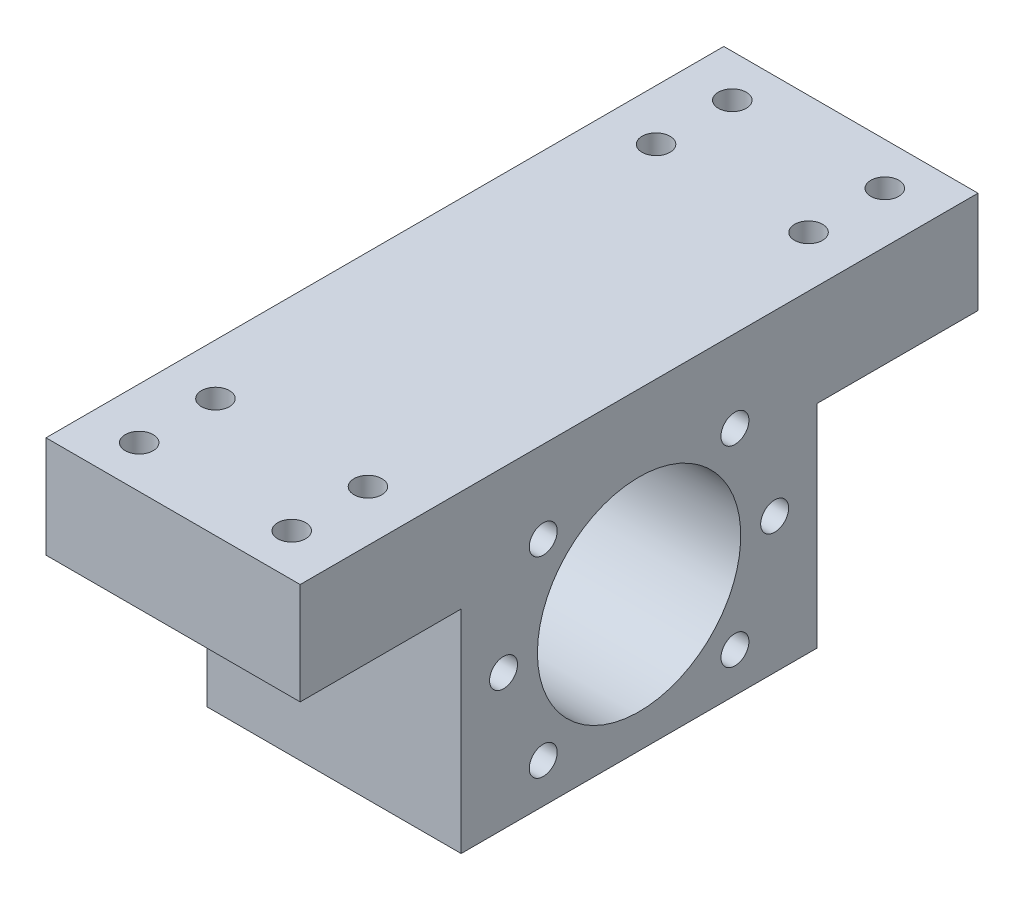
from build123d import *

# Parameters (mm, degrees)
SKETCH_2_W          = 80
SKETCH_2_H          = 82
EXTRUDE_2_DEPTH     = 30
SKETCH_3_R          = 12
CUT_EXTRUDE_1_DEPTH = 65.660652641
CUT_EXTRUDE_2_DEPTH = 65.660652641
HOLE_WIZARD_M4_1_D  = 3.3
HOLE_WIZARD_M4_2_D  = 3.3


with BuildPart() as part:
    # 草图2 → 凸台-拉伸2 (new body)
    with BuildSketch(Plane(origin=(0, 0, 0), x_dir=(0, 0, -1), z_dir=(1, 0, 0))):
        Rectangle(SKETCH_2_W, SKETCH_2_H)
    extrude(amount=EXTRUDE_2_DEPTH)

    # 草图3 → 切除-拉伸1 (cut, through all)
    with BuildSketch(Plane.ZY):
        with Locations((0, 20)):
            Circle(SKETCH_3_R)
    extrude(amount=-CUT_EXTRUDE_1_DEPTH, mode=Mode.SUBTRACT)

    # 草图7 → 切除-拉伸2 (cut, through all)
    with BuildSketch(Plane(origin=(30, 0, 0), x_dir=(0, 0, -1), z_dir=(1, 0, 0))):
        Polygon((-40, 29), (-21, 29), (-21, 4), (21, 4), (21, 29), (40, 29), (40, -41), (-40, -41), align=None)
    extrude(amount=-CUT_EXTRUDE_2_DEPTH, mode=Mode.SUBTRACT)

    # M4 螺纹孔1 (through all)
    with Locations(Plane.ZY):
        with Locations((-11.313708499, 31.313708499), (11.313708499, 8.686291501), (11.313708499, 31.313708499), (16, 20), (-11.313708499, 8.686291501), (-16, 20)):
            Hole(HOLE_WIZARD_M4_1_D / 2)

    # M4 螺纹孔2 (through all)
    with Locations(Plane(origin=(0, 29, 0), x_dir=(-1, 0, 0), z_dir=(0, -1, 0))):
        with Locations((-24, 35), (-6, 35), (-6, 26), (-24, 26), (-6, -35), (-6, -26), (-24, -26), (-24, -35)):
            Hole(HOLE_WIZARD_M4_2_D / 2)


solid = part.part
